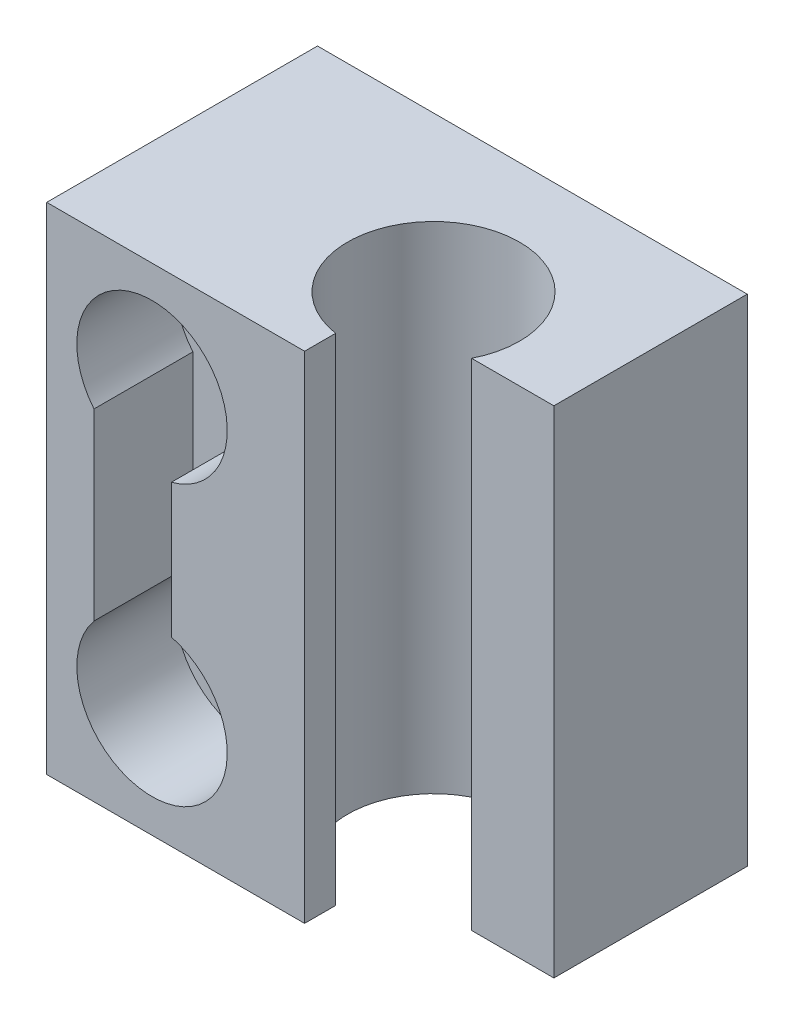
from build123d import *

# Parameters (mm, degrees)
SKETCH1_W           = 25.4
SKETCH1_H           = 29.2862
BOSS_EXTRUDE1_DEPTH = 16.002
CUT_EXTRUDE1_DEPTH  = 5.842
SKETCH3_R           = 1.905
CUT_EXTRUDE2_DEPTH  = 80.18158073
CUT_EXTRUDE3_DEPTH  = 81.01960028


with BuildPart() as part:
    # Sketch1 → Boss-Extrude1 (new body)
    with BuildSketch(Plane.XY):
        with Locations((-60.028198895, -14.972879006)):
            Rectangle(SKETCH1_W, SKETCH1_H)
    extrude(amount=BOSS_EXTRUDE1_DEPTH)

    # Sketch2 → Cut-Extrude1 (cut)
    with BuildSketch(Plane.XY.offset(16.002)):
        with BuildLine():
            Line((-69.934198895, -9.508203302), (-69.934198895, -20.361354709))
            ThreePointArc((-69.934198895, -20.361354709), (-65.147057291, -27.422210503), (-65.362198895, -18.894249236))
            Line((-65.362198895, -18.894249236), (-65.362198895, -10.975308775))
            ThreePointArc((-65.362198895, -10.975308775), (-65.147057291, -2.447347508), (-69.934198895, -9.508203302))
        make_face()
    extrude(amount=-CUT_EXTRUDE1_DEPTH, mode=Mode.SUBTRACT)

    # Sketch3 → Cut-Extrude2 (cut, through all)
    with BuildSketch(Plane.XY.offset(10.16)):
        with Locations((-66.505198895, -6.679779006)):
            Circle(SKETCH3_R)
        with Locations((-66.505198895, -23.189779006)):
            Circle(SKETCH3_R)
    extrude(amount=-CUT_EXTRUDE2_DEPTH, mode=Mode.SUBTRACT)

    # Sketch4 → Cut-Extrude3 (cut, through all)
    with BuildSketch(Plane(origin=(0, -0.329779006, 0), x_dir=(1, 0, 0), z_dir=(0, 1, 0))):
        with BuildLine():
            Line((-57.488198895, -16.002), (-57.488198895, -14.166524863))
            ThreePointArc((-57.488198895, -14.166524863), (-59.057296313, -4.63042217), (-52.189613836, -11.43))
            Line((-52.189613836, -11.43), (-47.328198895, -11.43))
            Line((-47.328198895, -11.43), (-47.328198895, -16.002))
            Line((-47.328198895, -16.002), (-57.488198895, -16.002))
        make_face()
    extrude(amount=-CUT_EXTRUDE3_DEPTH, mode=Mode.SUBTRACT)


solid = part.part
